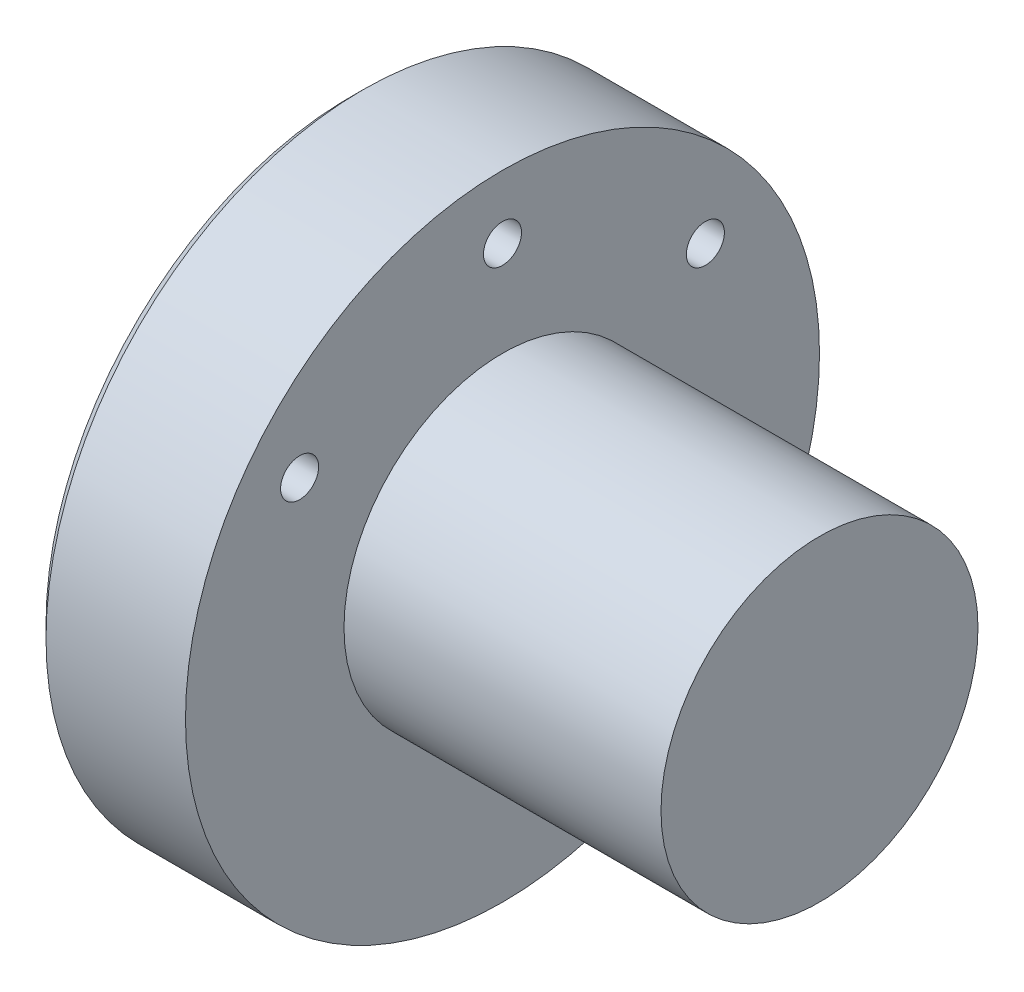
from build123d import *

# Parameters (mm, degrees)
CHAMFER1_SIZE      = 1
SKETCH2_R          = 1.5
CUT_EXTRUDE1_DEPTH = 52.176166328
CHAMFER2_SIZE      = 0.5


with BuildPart() as part:
    # Sketch1 → Revolve1 (revolve)
    with BuildSketch(Plane.XY, mode=Mode.PRIVATE) as revolve1_sk:
        Polygon((0, 0), (40, 0), (40, 12.5), (15, 12.5), (15, 25), (3, 25), (3, 6), (0, 6), align=None)
    revolve(revolve1_sk.sketch.rotate(Axis((0, 0, 0), (1, 0, 0)), 90), axis=Axis((0, 0, 0), (1, 0, 0)))

    # Chamfer1
    chamfer1_edges = [part.edges().sort_by_distance(p)[0] for p in [
        (0, 0, -6),
        (3, 0, -25),
    ]]
    chamfer(chamfer1_edges, length=CHAMFER1_SIZE)

    # Sketch2 → Cut-Extrude1 (cut, through all)
    with BuildSketch(Plane.ZY.offset(-3)):
        with Locations((-16, 12)):
            Circle(SKETCH2_R)
        with Locations((0, 20)):
            Circle(SKETCH2_R)
        with Locations((16, 12)):
            Circle(SKETCH2_R)
    extrude(amount=-CUT_EXTRUDE1_DEPTH, mode=Mode.SUBTRACT)

    # Chamfer2
    chamfer2_edges = [part.edges().sort_by_distance(p)[0] for p in [
        (3, 12, -17.5),
        (3, 20, -1.5),
        (3, 12, 14.5),
    ]]
    chamfer(chamfer2_edges, length=CHAMFER2_SIZE)


solid = part.part
